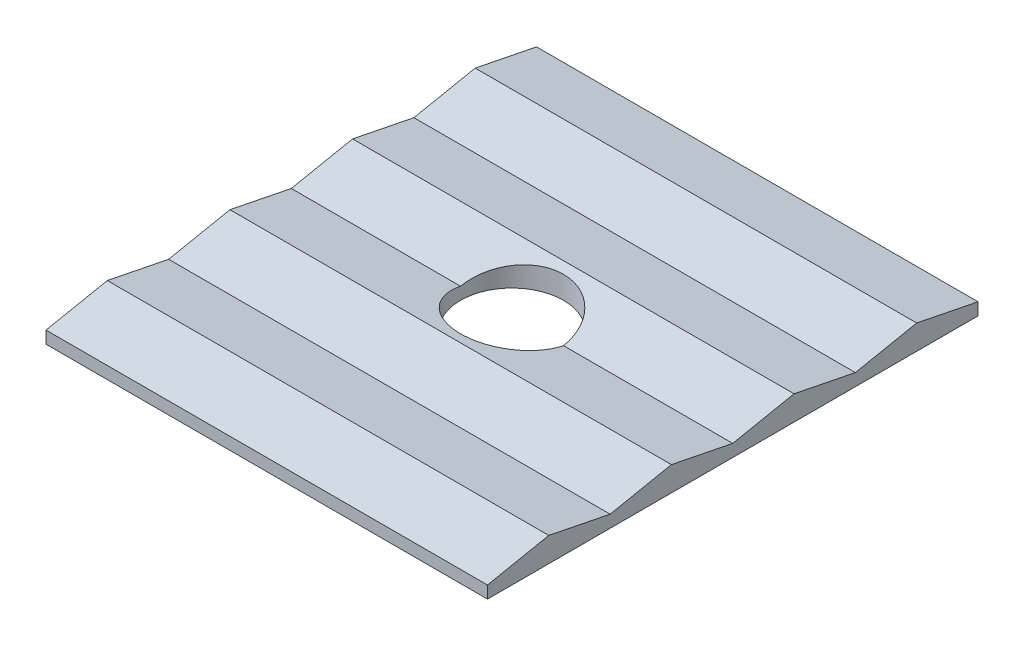
from build123d import *

# Parameters (mm, degrees)
BOSS_EXTRUDE1_DEPTH = 22.86
SKETCH7_R           = 2.667
CUT_EXTRUDE1_DEPTH  = 22.86


with BuildPart() as part:
    # Sketch6 → Boss-Extrude1 (new body)
    with BuildSketch(Plane(origin=(0, 0, 0), x_dir=(0, 0, -1), z_dir=(1, 0, 0))):
        Polygon((0, 0), (25.4, 0), (25.4, 0.635), (22.225, 1.27), (19.05, 0.635), (15.875, 1.27), (12.7, 0.635), (9.525, 1.27), (6.35, 0.635), (3.175, 1.27), (0, 0.635), align=None)
    extrude(amount=BOSS_EXTRUDE1_DEPTH)

    # Sketch7 → Cut-Extrude1 (cut)
    with BuildSketch(Plane.XZ):
        with Locations(Location((11.43, -12.7, 0), (0, 0, 270))):
            Circle(SKETCH7_R)
    extrude(amount=-CUT_EXTRUDE1_DEPTH, mode=Mode.SUBTRACT)


solid = part.part
